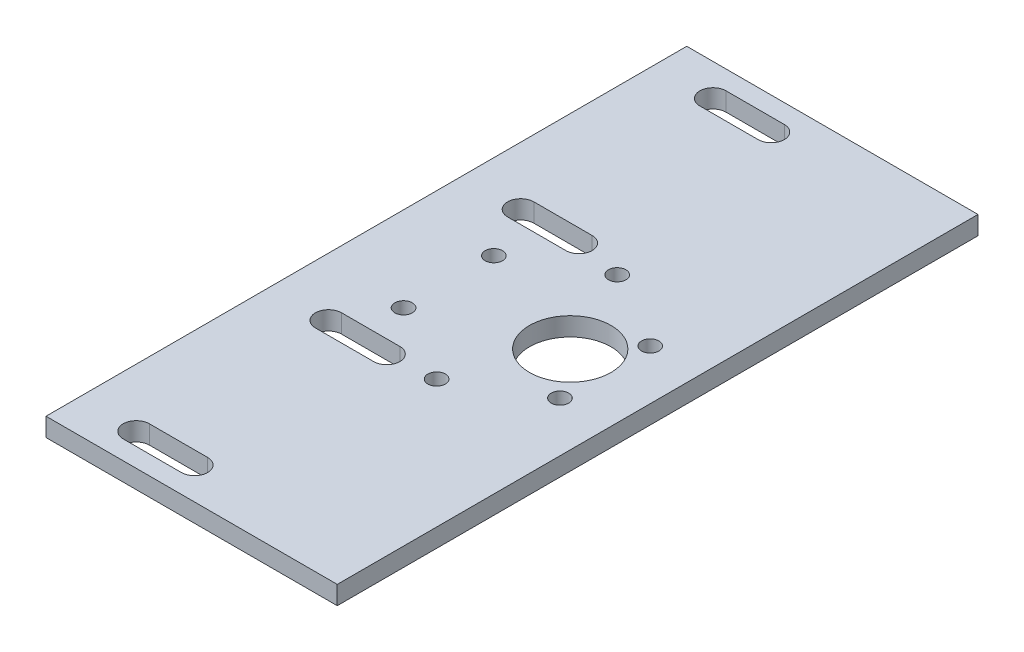
from build123d import *

# Parameters (mm, degrees)
SKETCH1_W           = 50
SKETCH1_H           = 110
SKETCH1_R           = 7
SKETCH1_R_2         = 1.5
BOSS_EXTRUDE1_DEPTH = 3.175
CUT_EXTRUDE1_DEPTH  = 10


with BuildPart() as part:
    # Sketch1 → Boss-Extrude1 (new body)
    with BuildSketch(Plane(origin=(0, 0, 0), x_dir=(1, 0, 0), z_dir=(0, 1, 0))):
        with Locations((25, 55)):
            Rectangle(SKETCH1_W, SKETCH1_H)
        with Locations(Location((35, 55, 0), (0, 0, 270))):
            Circle(SKETCH1_R, mode=Mode.SUBTRACT)
        with Locations(Location((41.423632142, 62.307271214, 0), (0, 0, 270))):
            Circle(SKETCH1_R_2, mode=Mode.SUBTRACT)
        with Locations(Location((41.423331921, 46.807271217, 0), (0, 0, 270))):
            Circle(SKETCH1_R_2, mode=Mode.SUBTRACT)
        with Locations(Location((27.999788054, 39.057531217, 0), (0, 0, 270))):
            Circle(SKETCH1_R_2, mode=Mode.SUBTRACT)
        with Locations(Location((14.576544409, 46.807791215, 0), (0, 0, 270))):
            Circle(SKETCH1_R_2, mode=Mode.SUBTRACT)
        with Locations(Location((14.57684463, 62.307791212, 0), (0, 0, 270))):
            Circle(SKETCH1_R_2, mode=Mode.SUBTRACT)
        with Locations(Location((28.000388497, 70.057531211, 0), (0, 0, 270))):
            Circle(SKETCH1_R_2, mode=Mode.SUBTRACT)
    extrude(amount=BOSS_EXTRUDE1_DEPTH)

    # Sketch2 → Cut-Extrude1 (cut)
    with BuildSketch(Plane(origin=(0, 3.175, 0), x_dir=(1, 0, 0), z_dir=(0, 1, 0))):
        with BuildLine():
            Line((10, 3.25), (20, 3.25))
            ThreePointArc((20, 3.25), (22.25, 5.5), (20, 7.75))
            Line((20, 7.75), (10, 7.75))
            ThreePointArc((10, 7.75), (7.75, 5.5), (10, 3.25))
        make_face()
        with BuildLine():
            Line((10, 36.25), (20, 36.25))
            ThreePointArc((20, 36.25), (22.25, 38.5), (20, 40.75))
            Line((20, 40.75), (10, 40.75))
            ThreePointArc((10, 40.75), (7.75, 38.5), (10, 36.25))
        make_face()
        with BuildLine():
            Line((10, 69.25), (20, 69.25))
            ThreePointArc((20, 69.25), (22.25, 71.5), (20, 73.75))
            Line((20, 73.75), (10, 73.75))
            ThreePointArc((10, 73.75), (7.75, 71.5), (10, 69.25))
        make_face()
        with BuildLine():
            Line((10, 102.25), (20, 102.25))
            ThreePointArc((20, 102.25), (22.25, 104.5), (20, 106.75))
            Line((20, 106.75), (10, 106.75))
            ThreePointArc((10, 106.75), (7.75, 104.5), (10, 102.25))
        make_face()
    extrude(amount=-CUT_EXTRUDE1_DEPTH, mode=Mode.SUBTRACT)


solid = part.part
